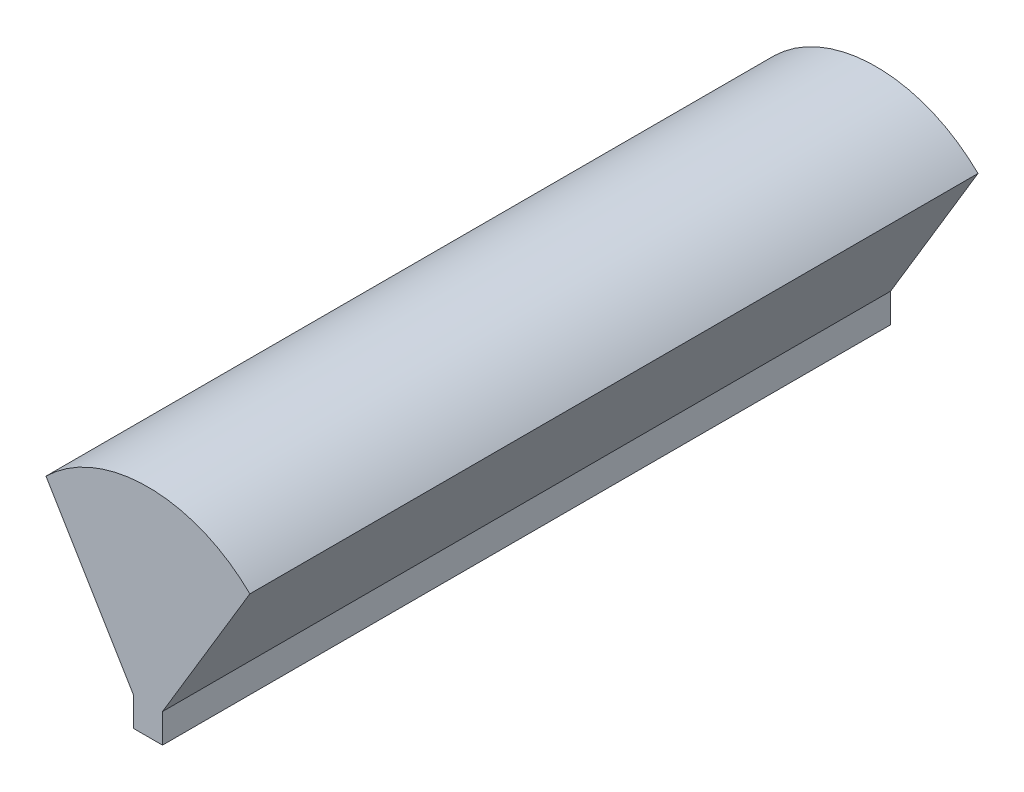
from build123d import *

# Parameters (mm, degrees)
BOSS_EXTRUDE1_DEPTH = 50
BOSS_EXTRUDE2_DEPTH = 50


with BuildPart() as part:
    # Sketch1 → Boss-Extrude1 (new body)
    with BuildSketch(Plane.XY):
        Polygon((0, 0), (2, 0), (2, 2), (8, 12), (-6, 12), (0, 2), align=None)
    extrude(amount=BOSS_EXTRUDE1_DEPTH)

    # Sketch2 → Boss-Extrude2 (add)
    with BuildSketch(Plane.XY.offset(50)):
        with BuildLine():
            Line((-6, 12), (8, 12))
            ThreePointArc((8, 12), (1, 14.858571571), (-6, 12))
        make_face()
    extrude(amount=-BOSS_EXTRUDE2_DEPTH)


solid = part.part
